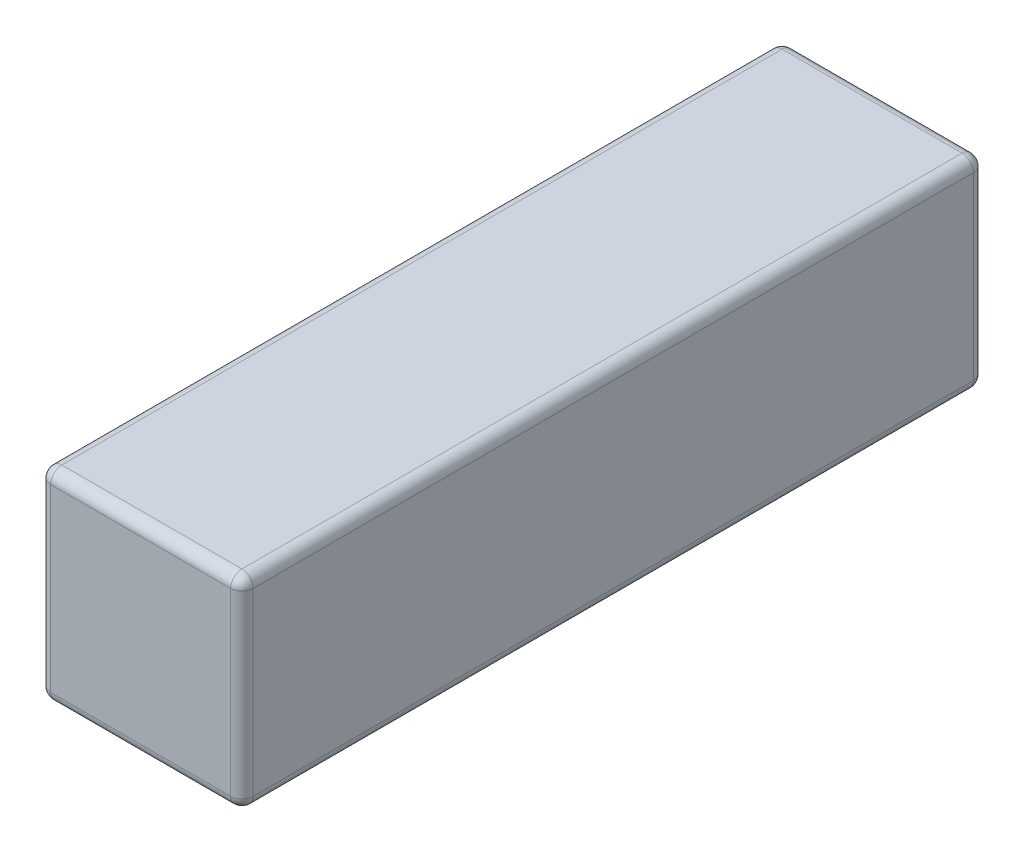
from build123d import *

# Parameters (mm, degrees)
SKETCH1_W           = 9
SKETCH1_H           = 9
BOSS_EXTRUDE1_DEPTH = 33
FILLET1_R           = 0.5


with BuildPart() as part:
    # Sketch1 → Boss-Extrude1 (new body)
    with BuildSketch(Plane.XY):
        Rectangle(SKETCH1_W, SKETCH1_H)
    extrude(amount=BOSS_EXTRUDE1_DEPTH)

    # Fillet1
    fillet1_edges = [part.edges().sort_by_distance(p)[0] for p in [
        (4.5, 0, 33),
        (0, 4.5, 33),
        (-4.5, 0, 33),
        (0, 4.5, 0),
        (4.5, 0, 0),
        (0, -4.5, 0),
        (-4.5, 0, 0),
        (0, -4.5, 33),
        (-4.5, 4.5, 16.5),
        (4.5, 4.5, 16.5),
        (4.5, -4.5, 16.5),
        (-4.5, -4.5, 16.5),
    ]]
    fillet(fillet1_edges, radius=FILLET1_R)


solid = part.part
